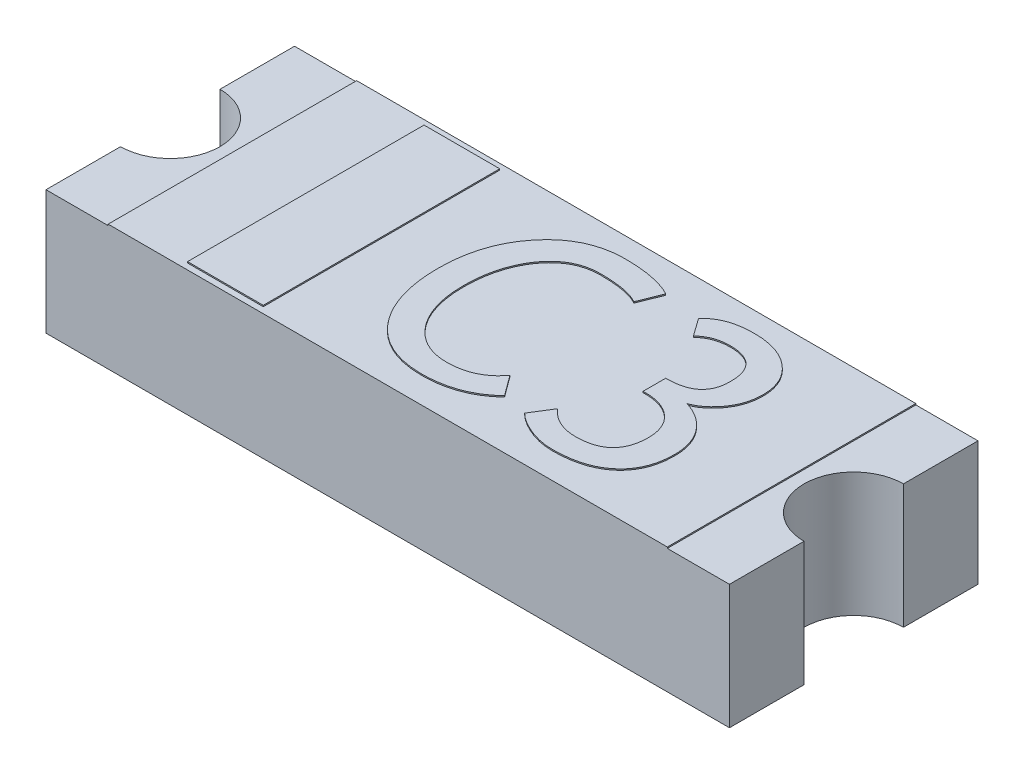
from build123d import *

# Parameters (mm, degrees)
SKETCH1_W           = 5.5
SKETCH1_H           = 2
BOSS_EXTRUDE1_DEPTH = 1
SKETCH2_W           = 4.5
SKETCH2_H           = 2
BOSS_EXTRUDE2_DEPTH = 0.01
SKETCH3_R           = 0.4
CUT_EXTRUDE1_DEPTH  = 3.01
SKETCH4_W           = 0.608914895
SKETCH4_H           = 1.902859046
BOSS_EXTRUDE3_DEPTH = 0.01
BOSS_EXTRUDE4_DEPTH = 0.01


with BuildPart() as part:
    # Sketch1 → Boss-Extrude1 (new body)
    with BuildSketch(Plane(origin=(0, 0, 0), x_dir=(1, 0, 0), z_dir=(0, 1, 0))):
        Rectangle(SKETCH1_W, SKETCH1_H)
    extrude(amount=BOSS_EXTRUDE1_DEPTH)

    # Sketch2 → Boss-Extrude2 (add)
    with BuildSketch(Plane(origin=(0, 1, 0), x_dir=(1, 0, 0), z_dir=(0, 1, 0))):
        Rectangle(SKETCH2_W, SKETCH2_H)
    extrude(amount=BOSS_EXTRUDE2_DEPTH)

    # Sketch3 → Cut-Extrude1 (cut)
    with BuildSketch(Plane(origin=(0, 1, 0), x_dir=(1, 0, 0), z_dir=(0, 1, 0))):
        with Locations((-2.75, 0)):
            Circle(SKETCH3_R)
        with Locations((2.75, 0)):
            Circle(SKETCH3_R)
    extrude(amount=-CUT_EXTRUDE1_DEPTH, mode=Mode.SUBTRACT)

    # Sketch4 → Boss-Extrude3 (add)
    with BuildSketch(Plane(origin=(0, 1.01, 0), x_dir=(1, 0, 0), z_dir=(0, 1, 0))):
        with Locations((-1.354835641, 0)):
            Rectangle(SKETCH4_W, SKETCH4_H)
    extrude(amount=BOSS_EXTRUDE3_DEPTH)

    # Sketch5 → Boss-Extrude4 (add)
    with BuildSketch(Plane(origin=(0, 1.01, 0), x_dir=(1, 0, 0), z_dir=(0, 1, 0))):
        with BuildLine():
            Line((0.489468741, 0.747638134), (0.415997606, 0.564910353))
            add(Edge.make_bspline(
                [(0.415997606, 0.564910353), (0.406697888, 0.569867917), (0.387302237, 0.580207498), (0.354953677, 0.592173717), (0.319277984, 0.603062382), (0.279625355, 0.611455245), (0.236370892, 0.617997615), (0.189229772, 0.622686868), (0.138404885, 0.625525596), (0.103221328, 0.625858766), (0.085060811, 0.626030737)],
                knots=[0, 0, 0, 0, 0.743181025, 1.549990972, 2.429353565, 3.375047818, 4.407890241, 5.516430014, 6.718068314, 8, 8, 8, 8], degree=3))
            add(Edge.make_bspline(
                [(0.085060811, 0.626030737), (0.067820457, 0.625484444), (0.034086281, 0.624415512), (-0.015278909, 0.615967668), (-0.061974282, 0.602058578), (-0.106177282, 0.582557537), (-0.14765492, 0.557402569), (-0.1861281, 0.526154519), (-0.222383973, 0.48999511), (-0.255452851, 0.448462792), (-0.285122339, 0.402565554), (-0.310934196, 0.353066798), (-0.33346585, 0.300598928), (-0.350916417, 0.244577966), (-0.364872629, 0.185525318), (-0.37498339, 0.123207692), (-0.381072094, 0.057702147), (-0.381720467, 0.012940033), (-0.382050934, -0.009874607)],
                knots=[0, 0, 0, 0, 0.93729464, 1.834003029, 2.715004989, 3.581291106, 4.454701967, 5.345101795, 6.270753011, 7.234680245, 8.226835646, 9.238713877, 10.267793776, 11.32822161, 12.42561983, 13.565859063, 14.75935147, 16, 16, 16, 16], degree=3))
            add(Edge.make_bspline(
                [(-0.382050934, -0.009874607), (-0.381760424, -0.03163826), (-0.381190786, -0.07431284), (-0.374553357, -0.136615696), (-0.364644032, -0.195836175), (-0.350338888, -0.251876374), (-0.332017392, -0.304739106), (-0.309795481, -0.354686368), (-0.283139561, -0.401162432), (-0.252839043, -0.444331957), (-0.21906848, -0.483036413), (-0.182954432, -0.517358611), (-0.143995478, -0.545946023), (-0.10298941, -0.569669418), (-0.059425977, -0.58785512), (-0.013498986, -0.600790885), (0.034836139, -0.609003157), (0.06792647, -0.609870376), (0.084744125, -0.610311127)],
                knots=[0, 0, 0, 0, 1.226633351, 2.40520583, 3.528543623, 4.609795719, 5.6620223, 6.679728427, 7.687447284, 8.678273178, 9.648614578, 10.579204689, 11.481557175, 12.366726839, 13.244420817, 14.135573581, 15.052433801, 16, 16, 16, 16], degree=3))
            add(Edge.make_bspline(
                [(0.084744125, -0.610311127), (0.102926266, -0.60984197), (0.138401661, -0.60892659), (0.190073913, -0.601286963), (0.23835487, -0.588234457), (0.28367946, -0.570469358), (0.325504304, -0.547199038), (0.364321299, -0.519157151), (0.399490499, -0.485514903), (0.419874169, -0.459925142), (0.430248473, -0.446901188)],
                knots=[0, 0, 0, 0, 1.097389961, 2.141130781, 3.144492999, 4.111406536, 5.072758937, 6.026305338, 6.995484689, 8, 8, 8, 8], degree=3))
            Line((0.430248473, -0.446901188), (0.55027244, -0.610311127))
            add(Edge.make_bspline(
                [(0.55027244, -0.610311127), (0.534316105, -0.624925416), (0.502600006, -0.653973956), (0.449827133, -0.690988243), (0.393849001, -0.72257832), (0.334361491, -0.748225059), (0.271573675, -0.768296685), (0.205385952, -0.782420627), (0.135859629, -0.791164359), (0.088359412, -0.79219642), (0.06415954, -0.792722222)],
                knots=[0, 0, 0, 0, 0.973901451, 1.935805146, 2.896097029, 3.865214868, 4.848786196, 5.860812937, 6.910151201, 8, 8, 8, 8], degree=3))
            add(Edge.make_bspline(
                [(0.06415954, -0.792722222), (0.038889338, -0.792098346), (-0.010504397, -0.790878902), (-0.082418312, -0.780034352), (-0.150444038, -0.763268034), (-0.214098264, -0.738566212), (-0.273847304, -0.707448759), (-0.329321596, -0.669104214), (-0.380592898, -0.623763341), (-0.42732474, -0.571830444), (-0.468940861, -0.514113813), (-0.505586889, -0.451841596), (-0.536272742, -0.384910987), (-0.561637789, -0.313823143), (-0.581317785, -0.238267889), (-0.595037713, -0.158390402), (-0.603390929, -0.07402316), (-0.604453205, -0.016333608), (-0.604997827, 0.013243466)],
                knots=[0, 0, 0, 0, 1.026774208, 2.006957187, 2.949983192, 3.86971466, 4.775767412, 5.68286642, 6.60415852, 7.552200267, 8.517071902, 9.492319463, 10.485049057, 11.505832625, 12.557165439, 13.655005808, 14.797736077, 16, 16, 16, 16], degree=3))
            add(Edge.make_bspline(
                [(-0.604997827, 0.013243466), (-0.604529323, 0.041878207), (-0.603608794, 0.098140525), (-0.594044548, 0.180487431), (-0.579362231, 0.259226074), (-0.558378761, 0.334250179), (-0.531578452, 0.405681652), (-0.49834474, 0.473257525), (-0.459327026, 0.537152792), (-0.414518921, 0.596701506), (-0.365217025, 0.651021366), (-0.311782928, 0.698603865), (-0.254664962, 0.738752728), (-0.194271659, 0.772052724), (-0.130061538, 0.797496986), (-0.06234496, 0.815428842), (0.008767006, 0.826964177), (0.057463904, 0.828121569), (0.082210637, 0.828709731)],
                knots=[0, 0, 0, 0, 1.151460384, 2.262420628, 3.330148846, 4.370797394, 5.392188392, 6.394959303, 7.395659951, 8.399554213, 9.388499259, 10.342092793, 11.271669333, 12.191485065, 13.110172784, 14.042422641, 15.005200576, 16, 16, 16, 16], degree=3))
            add(Edge.make_bspline(
                [(0.082210637, 0.828709731), (0.103328865, 0.828478819), (0.144440004, 0.828029298), (0.204259311, 0.82420384), (0.260599648, 0.817916164), (0.313388494, 0.809186295), (0.36269957, 0.797811142), (0.408342855, 0.783957014), (0.450585379, 0.767591168), (0.476692971, 0.754194033), (0.489468741, 0.747638134)],
                knots=[0, 0, 0, 0, 1.208331266, 2.352274815, 3.428237893, 4.451073276, 5.41226407, 6.321787922, 7.178765556, 8, 8, 8, 8], degree=3))
        make_face()
        with BuildLine():
            Line((0.752951434, -0.650846926), (0.854290931, -0.488703731))
            add(Edge.make_bspline(
                [(0.854290931, -0.488703731), (0.863161692, -0.498415383), (0.880627589, -0.517536934), (0.910023707, -0.542181777), (0.940901886, -0.563381337), (0.973756964, -0.580579068), (1.008415648, -0.593905095), (1.044738621, -0.603388845), (1.082745602, -0.609281633), (1.108673588, -0.609963528), (1.12189054, -0.610311127)],
                knots=[0, 0, 0, 0, 1.038536857, 2.044805075, 3.023619178, 3.993862689, 4.968400918, 5.951861625, 6.955948661, 8, 8, 8, 8], degree=3))
            add(Edge.make_bspline(
                [(1.12189054, -0.610311127), (1.134035641, -0.610024119), (1.15752335, -0.609469065), (1.191645799, -0.606450344), (1.223317421, -0.600759421), (1.25267319, -0.592826939), (1.279849021, -0.582797124), (1.304478112, -0.570041623), (1.327088829, -0.555434999), (1.347060288, -0.538148804), (1.364973366, -0.518818154), (1.380199787, -0.496984359), (1.393314613, -0.473155111), (1.403722392, -0.446834332), (1.411938402, -0.418421793), (1.417534825, -0.387647698), (1.421053001, -0.354721715), (1.421540848, -0.331953585), (1.421792115, -0.320226817)],
                knots=[0, 0, 0, 0, 1.217979382, 2.355480244, 3.430963224, 4.4400711, 5.401418145, 6.329258424, 7.215851497, 8.09412851, 8.97061781, 9.851633177, 10.756363982, 11.691960197, 12.683540408, 13.71738136, 14.824333005, 16, 16, 16, 16], degree=3))
            add(Edge.make_bspline(
                [(1.421792115, -0.320226817), (1.421619518, -0.309441082), (1.421281211, -0.288300003), (1.416545119, -0.25747658), (1.40966542, -0.228067525), (1.399961553, -0.200156139), (1.38695339, -0.174027404), (1.371990442, -0.149031097), (1.35317372, -0.126302514), (1.332521092, -0.104775819), (1.309326551, -0.085358181), (1.283941896, -0.068662275), (1.256893081, -0.05437749), (1.228144844, -0.042375369), (1.197325203, -0.033863216), (1.164901856, -0.026967926), (1.130527468, -0.023258662), (1.107014194, -0.022784751), (1.094972237, -0.022542044)],
                knots=[0, 0, 0, 0, 1.04000233, 2.038504785, 3.002252676, 3.952824288, 4.882360875, 5.815464042, 6.757424581, 7.722894219, 8.69211952, 9.669821937, 10.649698385, 11.641106595, 12.669718306, 13.730717932, 14.837822455, 16, 16, 16, 16], degree=3))
            Line((1.094972237, -0.022542044), (1.077237825, -0.022542044))
            Line((1.077237825, -0.022542044), (1.077237825, 0.15986905))
            Line((1.077237825, 0.15986905), (1.087055088, 0.15986905))
            add(Edge.make_bspline(
                [(1.087055088, 0.15986905), (1.098147844, 0.160026273), (1.119633166, 0.160330793), (1.150698333, 0.163379961), (1.179699906, 0.167458725), (1.206383403, 0.174396743), (1.231281641, 0.182306075), (1.253765549, 0.192924856), (1.274299258, 0.205018834), (1.292803355, 0.218823591), (1.308670638, 0.234982137), (1.322886208, 0.252567048), (1.334896304, 0.272116154), (1.344399007, 0.293807291), (1.35211893, 0.317094598), (1.356814159, 0.342466553), (1.360702617, 0.369397302), (1.36089125, 0.38807775), (1.360988416, 0.397700183)],
                knots=[0, 0, 0, 0, 1.280729984, 2.480618509, 3.603185272, 4.658871468, 5.661325427, 6.615925196, 7.523423809, 8.41104778, 9.273184394, 10.131952094, 11.018570638, 11.913616274, 12.862123289, 13.8448834, 14.889884024, 16, 16, 16, 16], degree=3))
            add(Edge.make_bspline(
                [(1.360988416, 0.397700183), (1.360807078, 0.407733771), (1.360455074, 0.42721048), (1.357710841, 0.455524597), (1.352534961, 0.481734593), (1.345997536, 0.506209926), (1.337187729, 0.528633513), (1.326224884, 0.54916103), (1.313683826, 0.567902144), (1.298907378, 0.584662341), (1.282005856, 0.599079221), (1.263537074, 0.612121914), (1.24263951, 0.622307021), (1.220204118, 0.63141829), (1.195557373, 0.637777199), (1.169269228, 0.643034985), (1.14084364, 0.645771934), (1.121262012, 0.646118958), (1.111123219, 0.646298636)],
                knots=[0, 0, 0, 0, 1.190816825, 2.311555071, 3.37057964, 4.358439532, 5.314648657, 6.222609832, 7.115667526, 7.985485622, 8.864726834, 9.747442442, 10.660747145, 11.616956271, 12.616897868, 13.675922438, 14.796660683, 16, 16, 16, 16], degree=3))
            add(Edge.make_bspline(
                [(1.111123219, 0.646298636), (1.1000278, 0.646068691), (1.078402054, 0.64562051), (1.046921998, 0.641754608), (1.017227758, 0.63544366), (0.989222022, 0.626545278), (0.962832419, 0.615207925), (0.938284198, 0.601066053), (0.915257053, 0.584722167), (0.901646573, 0.571734705), (0.89482673, 0.565227039)],
                knots=[0, 0, 0, 0, 1.121648649, 2.186171593, 3.201608459, 4.187379892, 5.153123794, 6.099801165, 7.047861733, 8, 8, 8, 8], degree=3))
            Line((0.89482673, 0.565227039), (0.793487233, 0.707102335))
            add(Edge.make_bspline(
                [(0.793487233, 0.707102335), (0.802198646, 0.716868603), (0.819669092, 0.736454525), (0.85102083, 0.761355153), (0.886449885, 0.782291214), (0.92597552, 0.799317811), (0.969507518, 0.812682565), (1.017164674, 0.821959862), (1.068968001, 0.827724948), (1.104879026, 0.828373768), (1.12347397, 0.828709731)],
                knots=[0, 0, 0, 0, 0.862636849, 1.72998913, 2.629873542, 3.572323633, 4.56417703, 5.63012423, 6.772864127, 8, 8, 8, 8], degree=3))
            add(Edge.make_bspline(
                [(1.12347397, 0.828709731), (1.140064483, 0.828477959), (1.172599194, 0.828023445), (1.220107483, 0.822337602), (1.265371614, 0.813956947), (1.308221974, 0.80194772), (1.348729372, 0.786357774), (1.386756808, 0.767305042), (1.422653742, 0.745040266), (1.45559309, 0.719145175), (1.485608384, 0.690750789), (1.51217713, 0.660438705), (1.534121873, 0.627582506), (1.552667738, 0.593259872), (1.566643186, 0.556583112), (1.576748954, 0.518275579), (1.582984372, 0.477919992), (1.583613733, 0.450398309), (1.58393531, 0.436335866)],
                knots=[0, 0, 0, 0, 1.174031114, 2.302325588, 3.382665022, 4.430881462, 5.448295056, 6.451052927, 7.438202281, 8.433944156, 9.412025818, 10.360532056, 11.280941432, 12.203775334, 13.117086605, 14.052546184, 15.004931568, 16, 16, 16, 16], degree=3))
            add(Edge.make_bspline(
                [(1.58393531, 0.436335866), (1.583637938, 0.425563161), (1.583050693, 0.404289462), (1.580010084, 0.37280148), (1.574165647, 0.342348917), (1.566407935, 0.312707794), (1.555629118, 0.284202515), (1.543584008, 0.256214356), (1.528458136, 0.229550487), (1.505998565, 0.196054177), (1.475279568, 0.1578582), (1.433799492, 0.11963527), (1.389406964, 0.088635641), (1.356847922, 0.075279282), (1.340720517, 0.068663503)],
                knots=[0, 0, 0, 0, 0.828199261, 1.635509591, 2.427965607, 3.209295653, 3.987036851, 4.767987682, 5.548938513, 6.338773594, 7.866953284, 9.302353965, 10.663780371, 12, 12, 12, 12], degree=3))
            add(Edge.make_bspline(
                [(1.340720517, 0.068663503), (1.352071838, 0.064803842), (1.374528373, 0.0571682), (1.406828077, 0.043213992), (1.437211477, 0.027292094), (1.46616551, 0.009906481), (1.492812476, -0.010143428), (1.518063714, -0.031657521), (1.541216195, -0.055308747), (1.562743896, -0.080491756), (1.582103583, -0.107450355), (1.599071652, -0.135971364), (1.612704765, -0.166210313), (1.624834939, -0.197350729), (1.633424652, -0.230239962), (1.640249313, -0.264358458), (1.644008396, -0.299980181), (1.644493049, -0.324124634), (1.644739008, -0.336377799)],
                knots=[0, 0, 0, 0, 1.055447645, 2.088012369, 3.09413145, 4.074545923, 5.057996083, 6.026886297, 6.993097546, 7.969051451, 8.941546561, 9.91239665, 10.885557867, 11.859251642, 12.851404877, 13.874090383, 14.921113544, 16, 16, 16, 16], degree=3))
            add(Edge.make_bspline(
                [(1.644739008, -0.336377799), (1.644314479, -0.354131846), (1.643490357, -0.388597054), (1.637074723, -0.438770977), (1.62643476, -0.485824957), (1.611134724, -0.529907713), (1.591537914, -0.570851655), (1.56749944, -0.608695042), (1.539171567, -0.643295633), (1.506734954, -0.674847392), (1.470247855, -0.702589494), (1.430229484, -0.726876231), (1.386867335, -0.747467523), (1.33977215, -0.763906013), (1.289320558, -0.776768216), (1.235465501, -0.786332416), (1.178049793, -0.791605282), (1.138685299, -0.792342467), (1.118406995, -0.792722222)],
                knots=[0, 0, 0, 0, 1.076748463, 2.090247896, 3.062677038, 3.998313011, 4.914842195, 5.810187554, 6.711307997, 7.621551821, 8.548845232, 9.485641922, 10.456678472, 11.455177368, 12.506665478, 13.612108712, 14.769896945, 16, 16, 16, 16], degree=3))
            add(Edge.make_bspline(
                [(1.118406995, -0.792722222), (1.10095665, -0.792269763), (1.066086359, -0.791365633), (1.014152112, -0.782930154), (0.962627721, -0.770142954), (0.912734811, -0.751649791), (0.865500212, -0.730353368), (0.822941467, -0.70608669), (0.784971359, -0.680509429), (0.763390145, -0.660517101), (0.752951434, -0.650846926)],
                knots=[0, 0, 0, 0, 1.044062041, 2.086305175, 3.142463646, 4.21809082, 5.267362279, 6.2410051, 7.149184175, 8, 8, 8, 8], degree=3))
        make_face()
    extrude(amount=BOSS_EXTRUDE4_DEPTH)


solid = part.part
